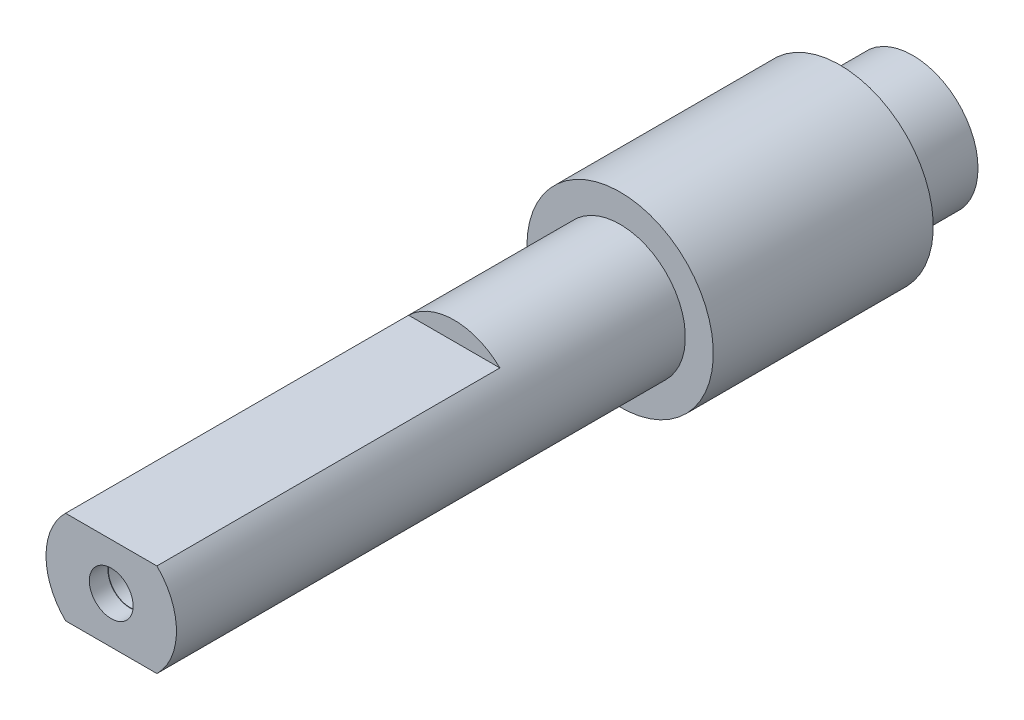
from build123d import *

# Parameters (mm, degrees)
SKETCH_1_R           = 3.5
EXTRUDE_1_DEPTH      = 43
SKETCH_2_OUTSIDE_W   = 17.824
SKETCH_2_OUTSIDE_H   = 17.824
SKETCH_2_OUTSIDE_W_2 = 10.593795304
SKETCH_2_OUTSIDE_H_2 = 5
CUT_EXTRUDE_1_DEPTH  = 18.4
EXTRUDE_START        = -3.9
SKETCH_5_R           = 5
EXTRUDE_2_DEPTH      = 11.8
SKETCH_3_R           = 1.175
CUT_EXTRUDE_2_DEPTH  = 1
SKETCH_6_R           = 1.15
CUT_EXTRUDE_3_DEPTH  = 6


with BuildPart() as part:
    # 草图1 → 凸台-拉伸1 (new body)
    with BuildSketch(Plane.XY):
        Circle(SKETCH_1_R)
    extrude(amount=EXTRUDE_1_DEPTH)

    # 草图2 outside → 切除-拉伸1 (cut)
    with BuildSketch(Plane.XY.offset(43)):
        Rectangle(SKETCH_2_OUTSIDE_W, SKETCH_2_OUTSIDE_H)
        Rectangle(SKETCH_2_OUTSIDE_W_2, SKETCH_2_OUTSIDE_H_2, mode=Mode.SUBTRACT)
    extrude(amount=-CUT_EXTRUDE_1_DEPTH, mode=Mode.SUBTRACT)

    # 草图5 → 凸台-拉伸2 (add)
    with BuildSketch(Plane(origin=(0, 0, 0), x_dir=(-1, 0, 0), z_dir=(0, 0, -1)).offset(EXTRUDE_START)):
        Circle(SKETCH_5_R)
    extrude(amount=-EXTRUDE_2_DEPTH)

    # 草图3 → 切除-拉伸2 (cut)
    with BuildSketch(Plane.XY.offset(43)):
        Circle(SKETCH_3_R)
    extrude(amount=-CUT_EXTRUDE_2_DEPTH, mode=Mode.SUBTRACT)

    # 草图6 → 切除-拉伸3 (cut)
    with BuildSketch(Plane.XY.offset(42)):
        Circle(SKETCH_6_R)
    extrude(amount=-CUT_EXTRUDE_3_DEPTH, mode=Mode.SUBTRACT)


solid = part.part
